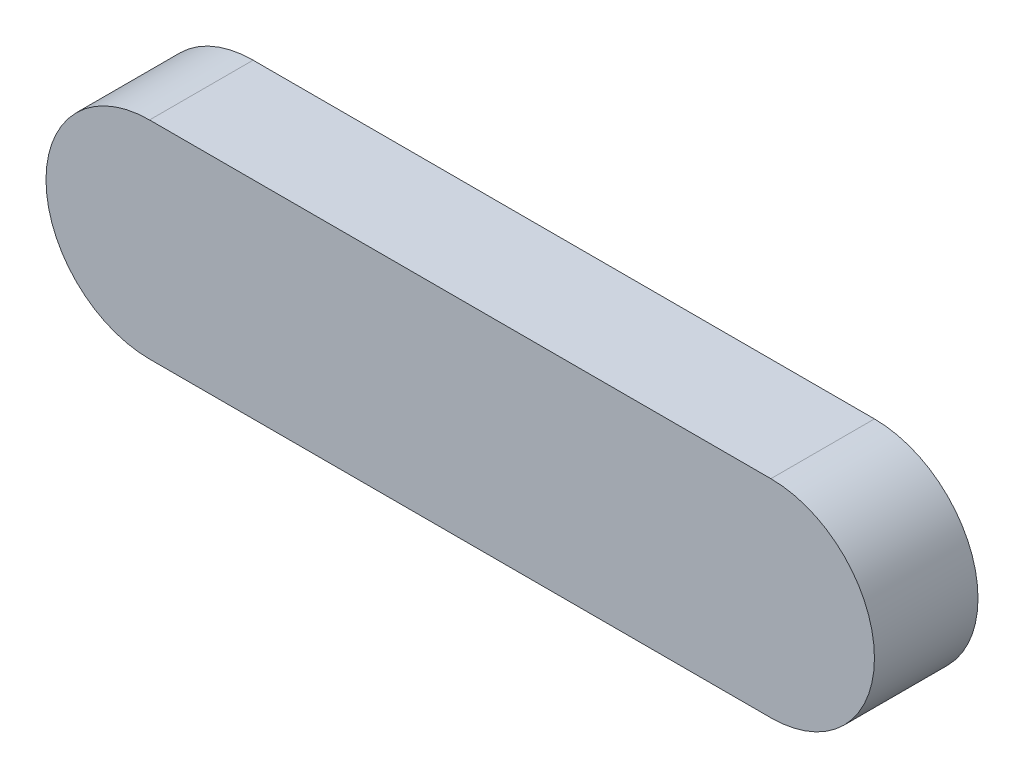
from build123d import *

# Parameters (mm, degrees)
BOSS_EXTRUDE1_DEPTH = 2.5


with BuildPart() as part:
    # Sketch1 → Boss-Extrude1 (new, symmetric)
    with BuildSketch(Plane.XY):
        with BuildLine():
            Line((-15, 5), (15, 5))
            ThreePointArc((15, 5), (20, 0), (15, -5))
            Line((15, -5), (-15, -5))
            ThreePointArc((-15, -5), (-20, 0), (-15, 5))
        make_face()
    extrude(amount=BOSS_EXTRUDE1_DEPTH, both=True)


solid = part.part
